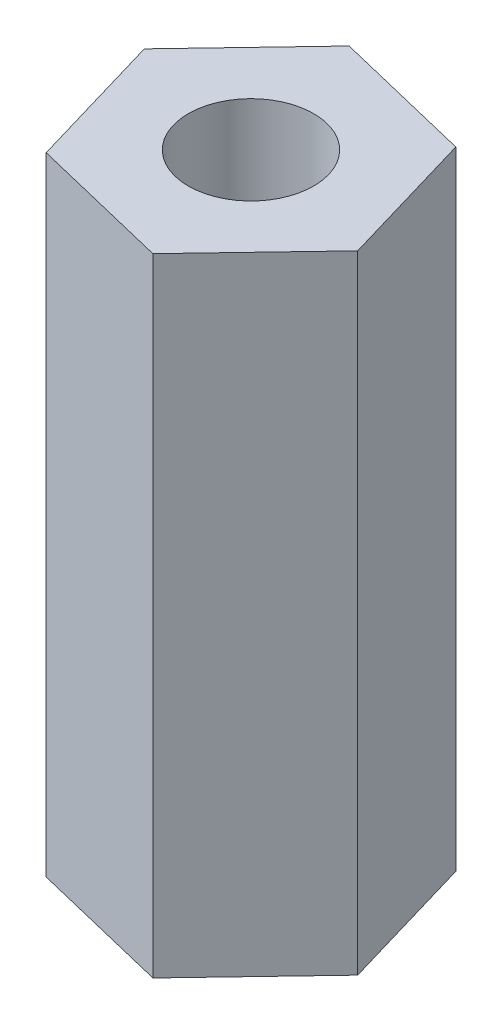
from build123d import *

# Parameters (mm, degrees)
SKETCH1_R           = 1.5
BOSS_EXTRUDE1_DEPTH = 7.5


with BuildPart() as part:
    # Sketch1 → Boss-Extrude1 (new, symmetric)
    with BuildSketch(Plane(origin=(0, 0, 0), x_dir=(1, 0, 0), z_dir=(0, 1, 0))):
        Polygon((0.977287067, -3.32338833), (3.366782253, -0.815338738), (2.389495187, 2.508049591), (-0.977287067, 3.32338833), (-3.366782253, 0.815338738), (-2.389495187, -2.508049591), align=None)
        with Locations(Location((0, 0, 0), (0, 0, 270))):
            Circle(SKETCH1_R, mode=Mode.SUBTRACT)
    extrude(amount=BOSS_EXTRUDE1_DEPTH, both=True)


solid = part.part
